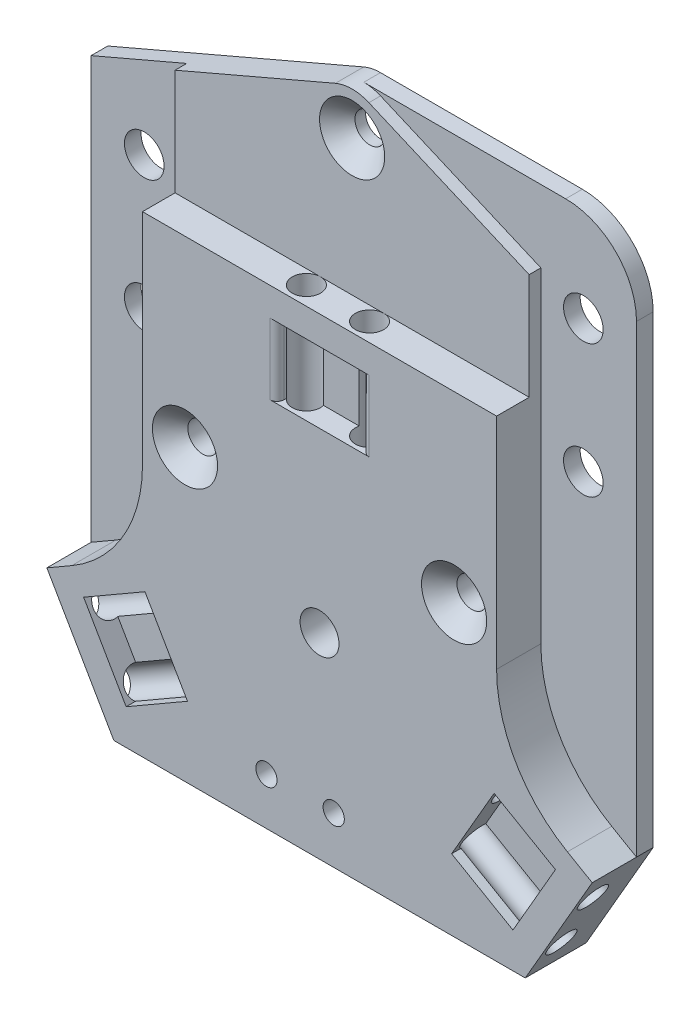
from build123d import *

# Parameters (mm, degrees)
BOSS_EXTRUDE1_DEPTH      = 2.6
BOSS_EXTRUDE1_DEPTH_BACK = 6
FILLET1_R                = 20
CUT_EXTRUDE1_DEPTH       = 5
SKETCH5_R                = 2
CUT_EXTRUDE2_DEPTH       = 20
FILLET3_R                = 1
CIRPATTERN1_COUNT        = 3
SKETCH6_R                = 2.75
CUT_EXTRUDE3_DEPTH       = 56.475677209
BOSS_EXTRUDE2_DEPTH      = 4
SKETCH8_R                = 2.1
CUT_EXTRUDE4_DEPTH       = 76.353770721
CHAMFER1_SIZE            = 2.5
SKETCH9_R                = 1.5
CUT_EXTRUDE5_DEPTH       = 76.353770721
BOSS_EXTRUDE3_START      = -2.35
BOSS_EXTRUDE3_DEPTH      = 2.35
BOSS_EXTRUDE4_DEPTH      = 2.35
SKETCH12_R               = 2.8
CUT_EXTRUDE6_DEPTH       = 2.35
FILLET4_R                = 10


with BuildPart() as part:
    # Sketch3 → Boss-Extrude1 (new, two sides: drawn at the far end of the back side and taken through both)
    with BuildSketch(Plane.XY.offset(-BOSS_EXTRUDE1_DEPTH_BACK)):
        Polygon((-25, 39), (25, 39), (25, -3.511595657), (38.504425224, -11.308379196), (33.774990748, -19.5), (29.045556271, -27.691620804), (-29.045556271, -27.691620804), (-33.774990748, -19.5), (-38.504425224, -11.308379196), (-25, -3.511595657), align=None)
    extrude(amount=BOSS_EXTRUDE1_DEPTH + BOSS_EXTRUDE1_DEPTH_BACK)

    # Fillet1
    fillet1_edges = [part.edges().sort_by_distance(p)[0] for p in [
        (-25, -3.511595657, -1.7),
        (25, -3.511595657, -1.7),
    ]]
    fillet(fillet1_edges, radius=FILLET1_R)

    # Sketch4 → Cut-Extrude1 (cut, symmetric)
    with BuildSketch(Plane(origin=(0, 30, 0), x_dir=(1, 0, 0), z_dir=(0, 1, 0))):
        Polygon((5.114783638, 0.485216362), (-5.114783638, 0.485216362), (-6, -0.4), (-6, -2.6), (6, -2.6), (6, -0.4), align=None)
    cut_extrude1 = extrude(amount=CUT_EXTRUDE1_DEPTH, both=True, mode=Mode.SUBTRACT)

    # Sketch5 → Cut-Extrude2 (cut)
    with BuildSketch(Plane(origin=(0, 39, 0), x_dir=(1, 0, 0), z_dir=(0, 1, 0))):
        with Locations((-4.458868953, 0)):
            Circle(SKETCH5_R)
        with Locations((4.458868953, 0)):
            Circle(SKETCH5_R)
    cut_extrude2 = extrude(amount=-CUT_EXTRUDE2_DEPTH, mode=Mode.SUBTRACT)

    # Fillet3
    fillet3_edges = [part.edges().sort_by_distance(p)[0] for p in [
        (-6, 30, 2.6),
        (6, 30, 2.6),
    ]]
    fillet(fillet3_edges, radius=FILLET3_R)

    # CirPattern1: Cut-Extrude1, Cut-Extrude2 ×3 about axis
    cirpattern1_axis = Axis((0, 0, -80.9), (0, 0, 1))
    add([cut_extrude1.rotate(cirpattern1_axis, i * 360 / CIRPATTERN1_COUNT) for i in range(1, CIRPATTERN1_COUNT)], mode=Mode.SUBTRACT)
    add([cut_extrude2.rotate(cirpattern1_axis, i * 360 / CIRPATTERN1_COUNT) for i in range(1, CIRPATTERN1_COUNT)], mode=Mode.SUBTRACT)

    # Sketch6 → Cut-Extrude3 (cut, through all)
    with BuildSketch(Plane.XY.offset(2.6)):
        Circle(SKETCH6_R)
    extrude(amount=-CUT_EXTRUDE3_DEPTH, mode=Mode.SUBTRACT)

    # Sketch7 → Boss-Extrude2 (add)
    with BuildSketch(Plane(origin=(0, 0, -6), x_dir=(-1, 0, 0), z_dir=(0, 0, -1))):
        with BuildLine():
            Line((-25, 39), (25, 39))
            Line((25, 39), (25, 54))
            Line((25, 54), (2.36629775, 63.713677082))
            ThreePointArc((2.36629775, 63.713677082), (0, 64.2), (-2.36629775, 63.713677082))
            Line((-2.36629775, 63.713677082), (-25, 54))
            Line((-25, 54), (-25, 39))
        make_face()
    extrude(amount=-BOSS_EXTRUDE2_DEPTH)

    # Sketch8 → Cut-Extrude4 (cut, through all)
    with BuildSketch(Plane.XY.offset(2.6)):
        with Locations((-19, 13.2)):
            Circle(SKETCH8_R)
        with Locations((19, 13.2)):
            Circle(SKETCH8_R)
        with Locations((0, 58.2)):
            Circle(SKETCH8_R)
    extrude(amount=-CUT_EXTRUDE4_DEPTH, mode=Mode.SUBTRACT)

    # Chamfer1
    chamfer1_edges = [part.edges().sort_by_distance(p)[0] for p in [
        (-21.1, 13.2, 2.6),
        (16.9, 13.2, 2.6),
        (-2.1, 58.2, -2),
    ]]
    chamfer(chamfer1_edges, length=CHAMFER1_SIZE)

    # Sketch9 → Cut-Extrude5 (cut, through all)
    with BuildSketch(Plane(origin=(0, 0, -6), x_dir=(-1, 0, 0), z_dir=(0, 0, -1))):
        with Locations((7.5, -21.041620804)):
            Circle(SKETCH9_R)
        with Locations((-2, -21.041620804)):
            Circle(SKETCH9_R)
    extrude(amount=-CUT_EXTRUDE5_DEPTH, mode=Mode.SUBTRACT)

    # Sketch10 → Boss-Extrude3 (add)
    with BuildSketch(Plane(origin=(0, 0, -6), x_dir=(-1, 0, 0), z_dir=(0, 0, -1)).offset(BOSS_EXTRUDE3_START)):
        with BuildLine():
            Line((25, 54), (38.504425224, 48.204323078))
            Line((38.504425224, 48.204323078), (38.504425224, -11.308379196))
            Line((38.504425224, -11.308379196), (35, -9.285098349))
            ThreePointArc((35, -9.285098349), (27.679491924, -1.964590274), (25, 8.035409726))
            Line((25, 8.035409726), (25, 54))
        make_face()
    extrude(amount=BOSS_EXTRUDE3_DEPTH)

    # Sketch11 → Boss-Extrude4 (add)
    with BuildSketch(Plane(origin=(0, 0, -6), x_dir=(-1, 0, 0), z_dir=(0, 0, -1))):
        with BuildLine():
            Line((-38.504425224, -11.308379196), (-38.504425224, 64.2))
            Line((-38.504425224, 64.2), (0, 64.2))
            ThreePointArc((0, 64.2), (-1.20787779, 64.077161836), (-2.36629775, 63.713677082))
            Line((-2.36629775, 63.713677082), (-25, 54))
            Line((-25, 54), (-25, 8.035409726))
            ThreePointArc((-25, 8.035409726), (-27.679491924, -1.964590274), (-35, -9.285098349))
            Line((-35, -9.285098349), (-38.504425224, -11.308379196))
        make_face()
    extrude(amount=-BOSS_EXTRUDE4_DEPTH)

    # Sketch12 → Cut-Extrude6 (cut)
    with BuildSketch(Plane.XY.offset(-3.65)):
        with Locations((-31, 39.8275)):
            Circle(SKETCH12_R)
        with Locations((31, 50.8275)):
            Circle(SKETCH12_R)
        with Locations((-31, 21.0775)):
            Circle(SKETCH12_R)
        with Locations((31, 32.0775)):
            Circle(SKETCH12_R)
    extrude(amount=-CUT_EXTRUDE6_DEPTH, mode=Mode.SUBTRACT)

    # Fillet4
    fillet4_edges = [part.edges().sort_by_distance(p)[0] for p in [
        (38.504425224, 64.2, -4.825),
    ]]
    fillet(fillet4_edges, radius=FILLET4_R)


solid = part.part
